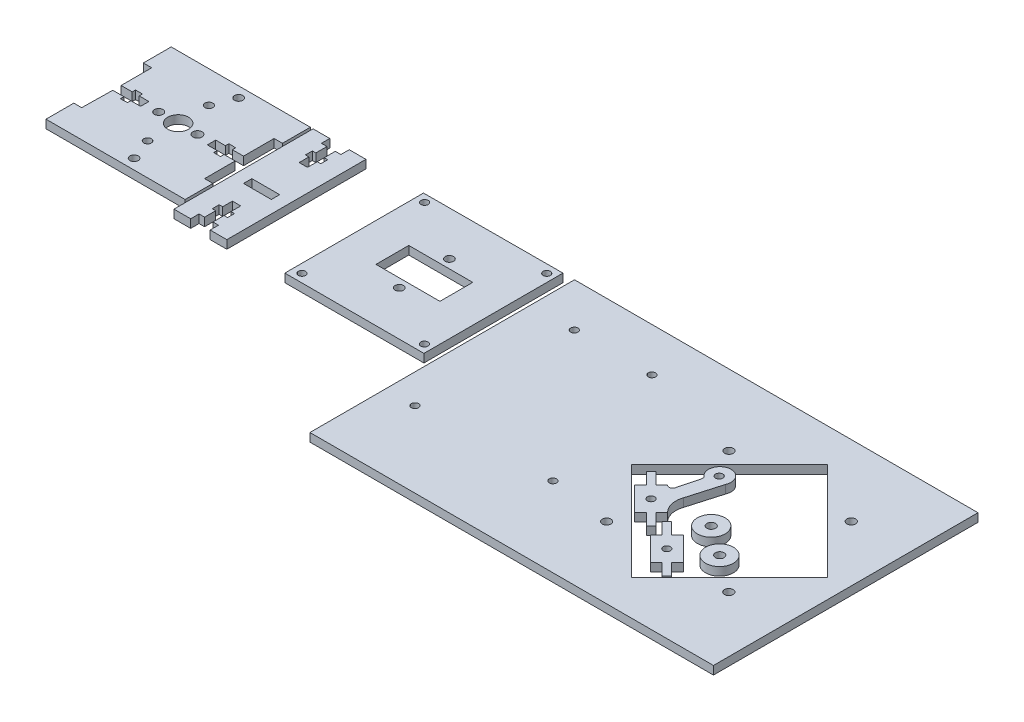
from build123d import *

# Parameters (mm, degrees)
SKETCH3_R             = 3.75
SKETCH3_R_2           = 1.53326
SKETCH3_R_3           = 1.42391285
SKETCH3_R_4           = 1.648176726
SKETCH3_R_5           = 1.5
SKETCH3_R_6           = 1.352434515
SKETCH3_R_7           = 1.489057141
BOSS_EXTRUDE1_DEPTH   = 3
SKETCH5_W             = 10
SKETCH5_H             = 3
BOSS_EXTRUDE2_DEPTH   = 3
SKETCH8_R             = 1.5
SKETCH8_R_2           = 1.500007616
SKETCH8_R_3           = 1.299978659
SKETCH8_R_4           = 1.299998754
SKETCH8_R_5           = 1.294984531
SKETCH8_R_6           = 1.2999789
SKETCH8_W             = 23
SKETCH8_H             = 11.8
BOSS_EXTRUDE3_DEPTH   = 3
SKETCH14_R            = 5.00001662
SKETCH14_R_2          = 1.550029918
BOSS_EXTRUDE5_DEPTH   = 3
SKETCH14_R_3          = 5.003976988
SKETCH14_R_4          = 1.550023427
BOSS_EXTRUDE5_2_DEPTH = 3
SKETCH14_R_5          = 1.299993938
SKETCH14_R_6          = 1.300026864
BOSS_EXTRUDE5_3_DEPTH = 3
SKETCH14_R_7          = 1.299969961
BOSS_EXTRUDE5_4_DEPTH = 3
SKETCH10_W            = 145.044336183
SKETCH10_H            = 95.097461227
SKETCH10_R            = 1.549963263
SKETCH10_R_2          = 1.2999789
SKETCH10_R_3          = 1.2905
SKETCH10_R_4          = 1.55
SKETCH10_R_5          = 1.564093454
SKETCH10_R_6          = 1.556446812
BOSS_EXTRUDE4_DEPTH   = 3


with BuildPart() as part:
    # Sketch3 → Boss-Extrude1 (new body)
    with BuildSketch(Plane(origin=(0, 0, 0), x_dir=(1, 0, 0), z_dir=(0, 1, 0))):
        Polygon((0, 0), (50, 0), (50, -10), (47, -10), (47, -21), (43, -21), (43, -19.82589), (40.5, -19.75), (40.5, -21), (37, -21), (37, -24), (40.5, -24), (40.5, -25.274955495), (43, -25.25), (43, -24), (47, -24), (47, -35), (50, -35), (50, -45), (0, -45), (0, -35), (2.827127063, -35), (3, -24), (7, -24), (7, -25.274955495), (9.5, -25.17411), (9.5, -24), (13, -24), (13, -21), (9.5, -21), (9.5, -19.82589), (7, -19.82589), (7, -21), (3, -21), (3, -10), (0, -10), align=None)
        with Locations(Location((25, -22.499992494, 0), (0, 0, 270))):
            Circle(SKETCH3_R, mode=Mode.SUBTRACT)
        with Locations(Location((18, -22.5, 0), (0, 0, 270))):
            Circle(SKETCH3_R_2, mode=Mode.SUBTRACT)
        with Locations(Location((24.990375, -11.417625, 0), (0, 0, 270))):
            Circle(SKETCH3_R_3, mode=Mode.SUBTRACT)
        with Locations(Location((31.950646971, -22.511932172, 0), (0, 0, 270))):
            Circle(SKETCH3_R_4, mode=Mode.SUBTRACT)
        with Locations(Location((28, -3.75, 0), (0, 0, 270))):
            Circle(SKETCH3_R_5, mode=Mode.SUBTRACT)
        with Locations(Location((25, -33.494077682, 0), (0, 0, 270))):
            Circle(SKETCH3_R_6, mode=Mode.SUBTRACT)
        with Locations(Location((27.986369291, -41.339428739, 0), (0, 0, 270))):
            Circle(SKETCH3_R_7, mode=Mode.SUBTRACT)
    extrude(amount=BOSS_EXTRUDE1_DEPTH)


with BuildPart() as body_2:
    # Sketch5 → Boss-Extrude2 (new body)
    with BuildSketch(Plane(origin=(0, 0, 0), x_dir=(1, 0, 0), z_dir=(0, 1, 0))):
        Polygon((57, 0), (57, -3), (59, -3), (59, -7), (57.75, -7), (57.75, -9.5), (59, -9.5), (59, -13), (62, -13), (62, -9.5), (63.25, -9.5), (63.25, -7), (62, -7), (62, -3), (64, -3), (64, 0), (70, 0), (70, -50), (64, -50), (64, -47), (62, -47), (62, -43), (63.25, -43), (63.25, -40.5), (62, -40.5), (62, -37), (59, -37), (59, -40.5), (57.75, -40.5), (57.75, -43), (59, -43), (59, -47), (57, -47), (57, -50), (51, -50), (51, 0), align=None)
        with Locations((60.5, -28)):
            Rectangle(SKETCH5_W, SKETCH5_H, mode=Mode.SUBTRACT)
    extrude(amount=BOSS_EXTRUDE2_DEPTH)


with BuildPart() as body_3:
    # Sketch8 → Boss-Extrude3 (new body)
    with BuildSketch(Plane(origin=(0, 0, 0), x_dir=(1, 0, 0), z_dir=(0, 1, 0))):
        Polygon((90.835790983, -0.1468305), (90.835790983, -49.979936215), (140.829753359, -49.979936215), (140.829753359, 0), align=None)
        with Locations(Location((116, -16.000034227, 0), (0, 0, 270))):
            Circle(SKETCH8_R, mode=Mode.SUBTRACT)
        with Locations(Location((116, -34, 0), (0, 0, 270))):
            Circle(SKETCH8_R_2, mode=Mode.SUBTRACT)
        with Locations(Location((138, -3, 0), (0, 0, 270))):
            Circle(SKETCH8_R_3, mode=Mode.SUBTRACT)
        with Locations(Location((94, -47, 0), (0, 0, 270))):
            Circle(SKETCH8_R_4, mode=Mode.SUBTRACT)
        with Locations(Location((93.972384297, -2.870240899, 0), (0, 0, 270))):
            Circle(SKETCH8_R_5, mode=Mode.SUBTRACT)
        with Locations(Location((138, -47, 0), (0, 0, 270))):
            Circle(SKETCH8_R_6, mode=Mode.SUBTRACT)
        with Locations((116, -25)):
            Rectangle(SKETCH8_W, SKETCH8_H, mode=Mode.SUBTRACT)
    extrude(amount=BOSS_EXTRUDE3_DEPTH)


with BuildPart() as body_4:
    # Sketch14 → Boss-Extrude5 (new body)
    with BuildSketch(Plane(origin=(0, 0, 0), x_dir=(1, 0, 0), z_dir=(0, 1, 0))):
        with Locations(Location((246.15535, -52.035605, 0), (0, 0, 270))):
            Circle(SKETCH14_R)
        with Locations(Location((246.15535, -52.035605, 0), (0, 0, 270))):
            Circle(SKETCH14_R_2, mode=Mode.SUBTRACT)
    extrude(amount=BOSS_EXTRUDE5_DEPTH)


with BuildPart() as body_5:
    # Sketch14 → Boss-Extrude5 2 (new body)
    with BuildSketch(Plane(origin=(0, 0, 0), x_dir=(1, 0, 0), z_dir=(0, 1, 0))):
        with Locations(Location((256.781771683, -59.687732945, 0), (0, 0, 270))):
            Circle(SKETCH14_R_3)
        with Locations(Location((256.82285, -59.64665, 0), (0, 0, 270))):
            Circle(SKETCH14_R_4, mode=Mode.SUBTRACT)
    extrude(amount=BOSS_EXTRUDE5_2_DEPTH)


with BuildPart() as body_6:
    # Sketch14 → Boss-Extrude5 3 (new body)
    with BuildSketch(Plane(origin=(0, 0, 0), x_dir=(1, 0, 0), z_dir=(0, 1, 0))):
        with BuildLine():
            Line((234.1407, -55.70278), (232.0194, -57.8241))
            Line((232.0194, -57.8241), (236.262, -62.06674))
            Line((236.262, -62.06674), (234.565, -63.7638))
            Line((234.565, -63.7638), (230.3223, -59.52115))
            Line((230.3223, -59.52115), (228.201, -61.64247))
            Line((228.201, -61.64247), (219.7157, -53.15719))
            Line((219.7157, -53.15719), (221.837, -51.03587))
            Line((221.837, -51.03587), (217.5944, -46.79323))
            Line((217.5944, -46.79323), (219.2915, -45.09618))
            Line((219.2915, -45.09618), (223.5341, -49.33882))
            Line((223.5341, -49.33882), (225.6554, -47.2175))
            ThreePointArc((225.6554, -47.2175), (227.096966061, -47.504240019), (227.913545624, -46.282139221))
            Line((227.913545624, -46.282139221), (229.7551, -39.43538))
            Line((229.7551, -39.43538), (229.7551, -38.198592891))
            ThreePointArc((229.7551, -38.198592891), (231.075391639, -31.018520336), (235.828906167, -36.559342615))
            Line((235.828906167, -36.559342615), (232.44365, -48.27816))
            ThreePointArc((232.44365, -48.27816), (232.223292436, -52.234785151), (234.1407, -55.70278))
        make_face()
        with Locations(Location((232.1046, -35.11147, 0), (0, 0, 270))):
            Circle(SKETCH14_R_5, mode=Mode.SUBTRACT)
        with Locations(Location((226.9282, -54.429985, 0), (0, 0, 270))):
            Circle(SKETCH14_R_6, mode=Mode.SUBTRACT)
    extrude(amount=BOSS_EXTRUDE5_3_DEPTH)


with BuildPart() as body_7:
    # Sketch14 → Boss-Extrude5 4 (new body)
    with BuildSketch(Plane(origin=(0, 0, 0), x_dir=(1, 0, 0), z_dir=(0, 1, 0))):
        Polygon((244.0402, -59.94542), (252.5255, -68.4307), (250.4042, -70.55202), (254.6468, -74.79466), (252.9497, -76.49172), (248.7071, -72.24908), (246.5858, -74.3704), (238.1005, -65.88512), (240.2218, -63.7638), (235.9792, -59.52115), (237.6762, -57.8241), (241.9189, -62.06674), align=None)
        with Locations(Location((245.313, -67.157905, 0), (0, 0, 270))):
            Circle(SKETCH14_R_7, mode=Mode.SUBTRACT)
    extrude(amount=BOSS_EXTRUDE5_4_DEPTH)


with BuildPart() as body_8:
    # Sketch10 → Boss-Extrude4 (new body)
    with BuildSketch(Plane(origin=(0, 0, 0), x_dir=(1, 0, 0), z_dir=(0, 1, 0))):
        with Locations((217.493156088, -47.548730614)):
            Rectangle(SKETCH10_W, SKETCH10_H)
        with Locations(Location((226, -25.5, 0), (0, 0, 270))):
            Circle(SKETCH10_R, mode=Mode.SUBTRACT)
        with Locations(Location((188.5, -15.7, 0), (0, 0, 270))):
            Circle(SKETCH10_R_2, mode=Mode.SUBTRACT)
        with Locations(Location((160.6, -15.7, 0), (0, 0, 270))):
            Circle(SKETCH10_R_2, mode=Mode.SUBTRACT)
        with Locations(Location((155.5, -67.875, 0), (0, 0, 270))):
            Circle(SKETCH10_R_3, mode=Mode.SUBTRACT)
        with Locations(Location((203.7, -66.5, 0), (0, 0, 270))):
            Circle(SKETCH10_R_2, mode=Mode.SUBTRACT)
        with Locations(Location((226, -69.5, 0), (0, 0, 270))):
            Circle(SKETCH10_R_4, mode=Mode.SUBTRACT)
        with Locations(Location((269.939993732, -25.491820621, 0), (0, 0, 270))):
            Circle(SKETCH10_R_5, mode=Mode.SUBTRACT)
        with Locations(Location((269.922899471, -69.483321735, 0), (0, 0, 270))):
            Circle(SKETCH10_R_6, mode=Mode.SUBTRACT)
        Polygon((247.98872777, -12.095839846), (283.198240379, -47.305352454), (247.98872777, -82.514865063), (212.779215162, -47.305352454), align=None, mode=Mode.SUBTRACT)
    extrude(amount=BOSS_EXTRUDE4_DEPTH)


solid = Compound([part.part, body_2.part, body_3.part, body_4.part, body_5.part, body_6.part, body_7.part, body_8.part])
